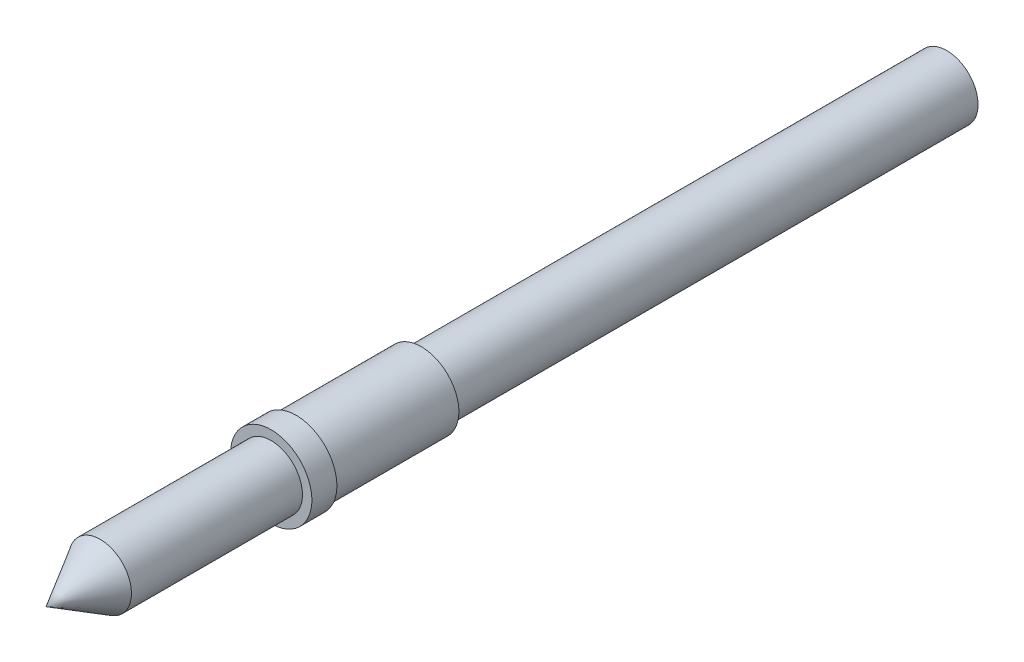
from build123d import *


with BuildPart() as part:
    # Sketch3 → Revolve2 (revolve)
    with BuildSketch(Plane(origin=(0, 0, 0), x_dir=(0, 0, -1), z_dir=(1, 0, 0)), mode=Mode.PRIVATE) as revolve2_sk:
        Polygon((-214.851846715, 7.9375), (-228.6, 0), (0, 0), (0, 7.9375), (-133.35, 7.9375), (-133.35, 9.525), (-165.1, 9.525), (-165.1, 10.31875), (-171.45, 10.31875), (-171.45, 7.9375), align=None)
    revolve(revolve2_sk.sketch.rotate(Axis((0, 0, 0), (0, 0, 1)), 90), axis=Axis((0, 0, 0), (0, 0, 1)))


solid = part.part
